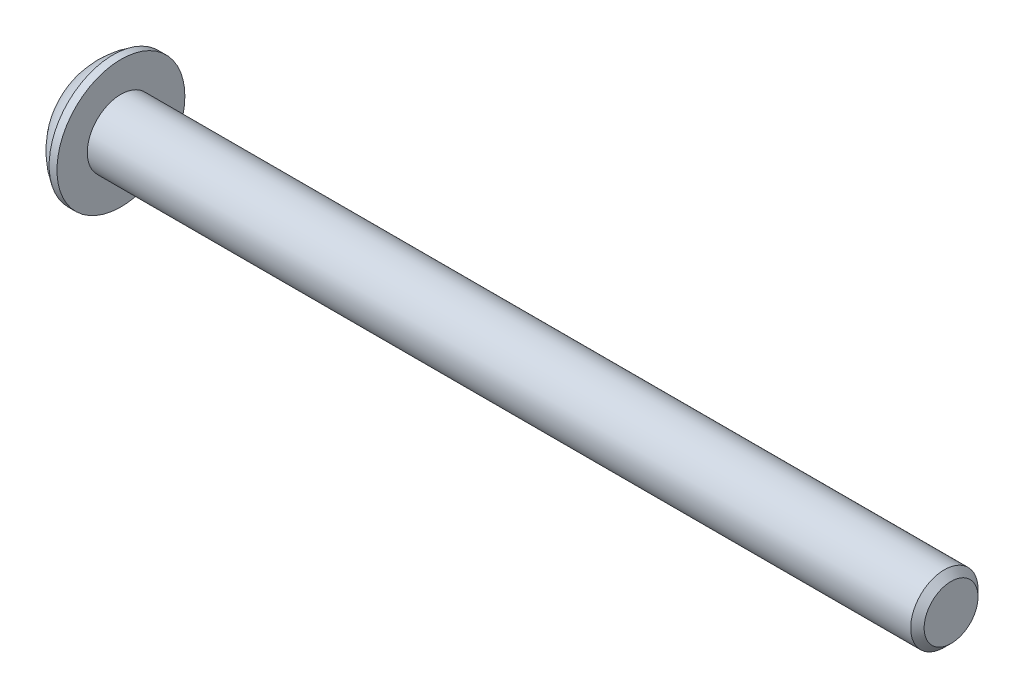
from build123d import *

# Parameters (mm, degrees)
CHAMFER1_SIZE      = 0.3
CUT_EXTRUDE1_DEPTH = 1


with BuildPart() as part:
    # Sketch2 → Revolve2 (revolve)
    with BuildSketch(Plane.XY, mode=Mode.PRIVATE) as revolve2_sk:
        with BuildLine():
            Line((18.5, 0), (-18.5, 0))
            Line((-18.5, 0), (-20.15, 0))
            Line((-20.15, 0), (-20.15, 1.43))
            ThreePointArc((-20.15, 1.43), (-19.604204204, 2.235398215), (-18.85, 2.85))
            Line((-18.85, 2.85), (-18.5, 2.85))
            Line((-18.5, 2.85), (-18.5, 1.5))
            Line((-18.5, 1.5), (18.5, 1.5))
            Line((18.5, 1.5), (18.5, 0))
        make_face()
    revolve(revolve2_sk.sketch.rotate(Axis((18.5, 0, 0), (-1, 0, 0)), 90), axis=Axis((18.5, 0, 0), (-1, 0, 0)))

    # Chamfer1
    chamfer1_edges = [part.edges().sort_by_distance(p)[0] for p in [
        (18.5, 0, 1.5),
    ]]
    chamfer(chamfer1_edges, length=CHAMFER1_SIZE)

    # Sketch3 → Cut-Extrude1 (cut)
    with BuildSketch(Plane.ZY.offset(20.15)):
        Polygon((-1, 0.577350269), (-1, -0.577350269), (0, -1.154700538), (1, -0.577350269), (1, 0.577350269), (0, 1.154700538), align=None)
    extrude(amount=-CUT_EXTRUDE1_DEPTH, mode=Mode.SUBTRACT)


solid = part.part
